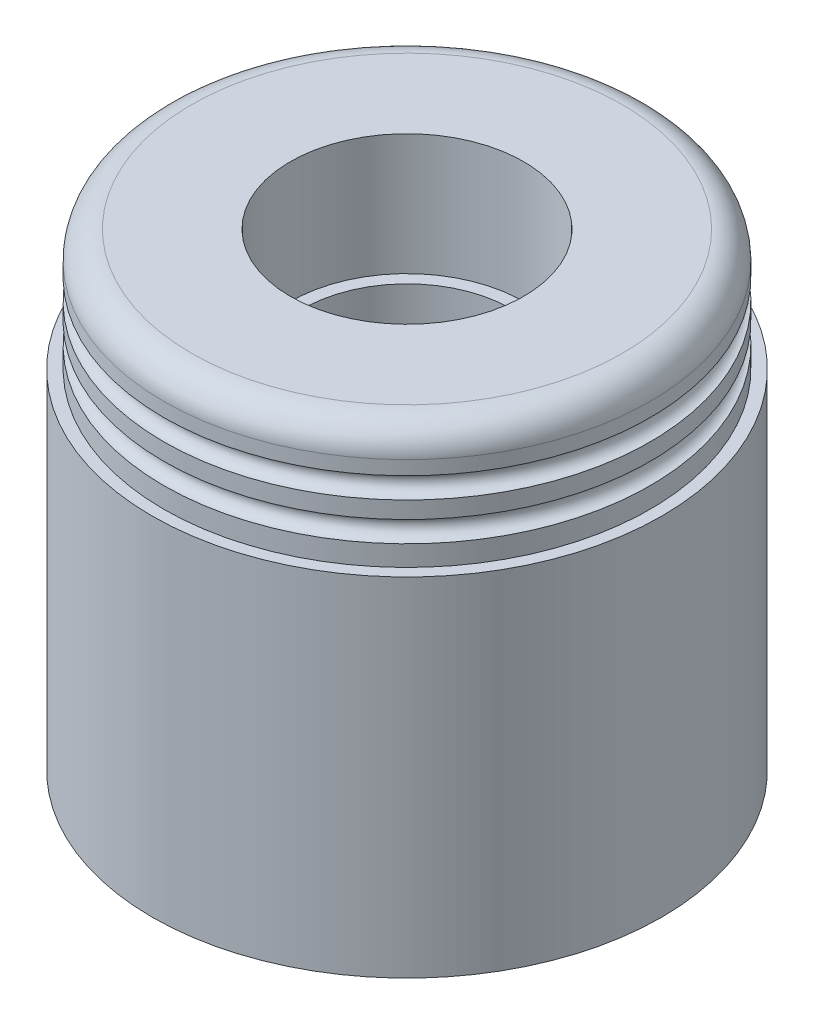
from build123d import *

# Parameters (mm, degrees)
SKETCH1_R   = 11.6459
SKETCH1_R_2 = 4.7625
LOWER_DEPTH = 15.875
SKETCH2_R   = 11.1125
SKETCH2_R_2 = 5.334
SEAT_DEPTH  = 5.5372
FILLET1_R   = 1.27


with BuildPart() as part:
    # Sketch1 → lower (new body)
    with BuildSketch(Plane(origin=(0, 0, 0), x_dir=(1, 0, 0), z_dir=(0, 1, 0))):
        with Locations(Location((0, 0, 0), (0, 0, 270))):
            Circle(SKETCH1_R)
        with Locations(Location((0, 0, 0), (0, 0, 270))):
            Circle(SKETCH1_R_2, mode=Mode.SUBTRACT)
    extrude(amount=LOWER_DEPTH)


with BuildPart() as body_2:
    # Sketch2 → seat (new body)
    with BuildSketch(Plane(origin=(0, 15.875, 0), x_dir=(1, 0, 0), z_dir=(0, 1, 0))):
        with Locations(Location((0, 0, 0), (0, 0, 270))):
            Circle(SKETCH2_R)
        with Locations(Location((0, 0, 0), (0, 0, 270))):
            Circle(SKETCH2_R_2, mode=Mode.SUBTRACT)
    extrude(amount=SEAT_DEPTH)

    # Fillet1
    fillet1_edges = [body_2.edges().sort_by_distance(p)[0] for p in [
        (0, 21.4122, -11.1125),
    ]]
    fillet(fillet1_edges, radius=FILLET1_R)

    # Sketch3 → Cut-Revolve1 (revolve, cut)
    with BuildSketch(Plane.XY, mode=Mode.PRIVATE) as cut_revolve1_sk:
        with BuildLine():
            Line((-11.1125, 20.1422), (-11.1125, 19.50391487))
            ThreePointArc((-11.1125, 19.50391487), (-10.632340758, 19.023755628), (-11.1125, 18.543596386))
            Line((-11.1125, 18.543596386), (-11.1125, 17.771082329))
            ThreePointArc((-11.1125, 17.771082329), (-10.632340758, 17.290923087), (-11.1125, 16.810763845))
            Line((-11.1125, 16.810763845), (-11.1125, 15.875))
            Line((-11.1125, 15.875), (-12.694987605, 15.875))
            Line((-12.694987605, 15.875), (-12.694987605, 20.1422))
            Line((-12.694987605, 20.1422), (-11.1125, 20.1422))
        make_face()
    revolve(cut_revolve1_sk.sketch.rotate(Axis((0, 0, 0), (0, 1, 0)), 270), axis=Axis((0, 0, 0), (0, 1, 0)), mode=Mode.SUBTRACT)


solid = Compound([part.part, body_2.part])
